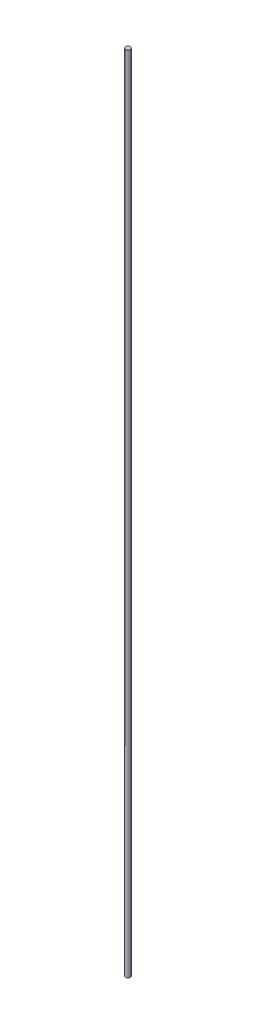
from build123d import *

# Parameters (mm, degrees)
SKETCH_1_R      = 1.5
EXTRUDE_1_DEPTH = 500


with BuildPart() as part:
    # Эскиз1 → Бобышка-Вытянуть1 (new body)
    with BuildSketch(Plane(origin=(0, 0, 0), x_dir=(1, 0, 0), z_dir=(0, 1, 0))):
        with Locations(Location((0, 0, 0), (0, 0, 270))):
            Circle(SKETCH_1_R)
    extrude(amount=EXTRUDE_1_DEPTH)


solid = part.part
